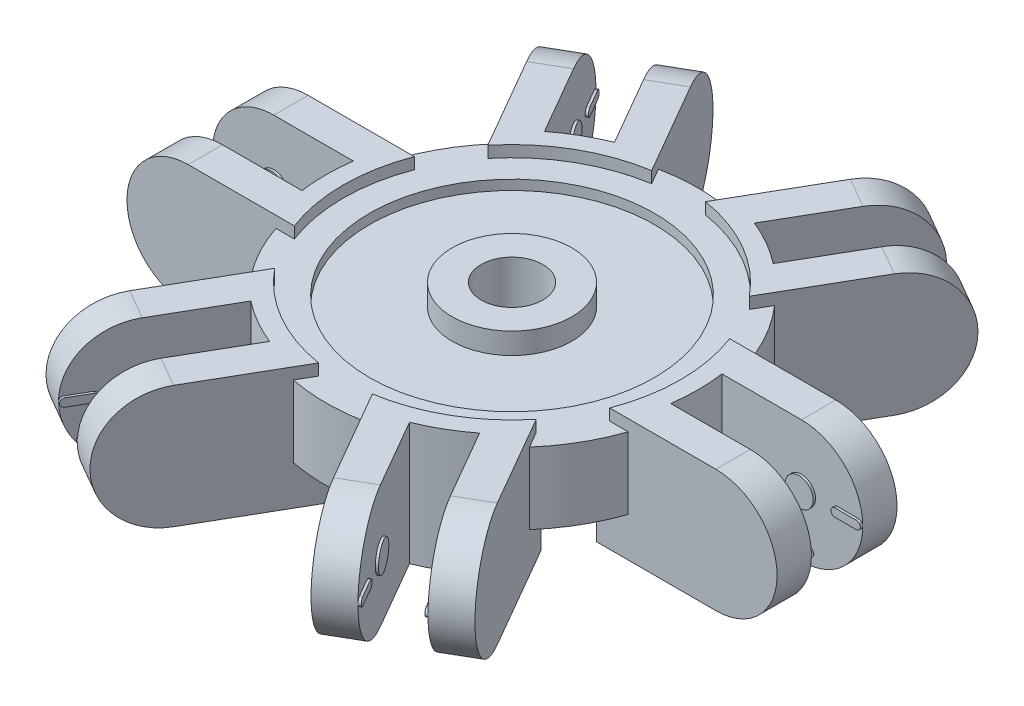
from build123d import *

# Parameters (mm, degrees)
SKETCH1_R                       = 14.9352
BOSS_EXTRUDE1_DEPTH             = 9.8298
SKETCH2_W                       = 13.3858
SKETCH2_H                       = 9.8298
BOSS_EXTRUDE2_DEPTH             = 4.8133
FILLET1_RADIUS                  = 4.9149
FILLET1_LENGTH                  = 9.6266
CUT_EXTRUDE1_DEPTH              = 32.625213497
SKETCH4_R                       = 1.1303
BOSS_EXTRUDE3_DEPTH             = 0.1905
CIRPATTERN5_COUNT               = 6
CIRPATTERN5_COPY_1_SKETCH_R     = 1.1303
CIRPATTERN5_COPY_1_DEPTH        = 0.1905
CIRPATTERN5_COPY_2_SKETCH_R     = 1.1303
CIRPATTERN5_COPY_2_DEPTH        = 0.1905
CIRPATTERN5_COPY_3_SKETCH_R     = 1.1303
CIRPATTERN5_COPY_3_DEPTH        = 0.1905
CIRPATTERN5_COPY_4_SKETCH_R     = 1.1303
CIRPATTERN5_COPY_4_DEPTH        = 0.1905
CIRPATTERN5_COPY_5_SKETCH_R     = 1.1303
CIRPATTERN5_COPY_5_DEPTH        = 0.1905
FILLET1_OF_CIRPATTERN5_2_RADIUS = 4.9149
FILLET1_OF_CIRPATTERN5_2_LENGTH = 9.6266
FILLET1_OF_CIRPATTERN5_3_RADIUS = 4.9149
FILLET1_OF_CIRPATTERN5_3_LENGTH = 9.6266
FILLET1_OF_CIRPATTERN5_4_RADIUS = 4.9149
FILLET1_OF_CIRPATTERN5_4_LENGTH = 9.6266
FILLET1_OF_CIRPATTERN5_5_RADIUS = 4.9149
FILLET1_OF_CIRPATTERN5_5_LENGTH = 9.6266
FILLET1_OF_CIRPATTERN5_6_RADIUS = 4.9149
FILLET1_OF_CIRPATTERN5_6_LENGTH = 9.6266
SKETCH7_R                       = 2.4765
CUT_EXTRUDE2_DEPTH              = 38.442952732
CUT_EXTRUDE5_DEPTH              = 0.9144
CIRPATTERN6_COUNT               = 6
SKETCH10_R                      = 13.5382
CUT_EXTRUDE6_DEPTH              = 0.9144
SKETCH11_R                      = 11.43
CUT_EXTRUDE7_DEPTH              = 0.7874
SKETCH12_R                      = 4.8006
BOSS_EXTRUDE5_DEPTH             = 1.7018
SKETCH13_R                      = 2.4765
CUT_EXTRUDE8_DEPTH              = 38.442952732
CUT_EXTRUDE9_DEPTH              = 3.175
CIRPATTERN7_COUNT               = 6
SKETCH15_R                      = 12.5476
CUT_EXTRUDE10_DEPTH             = 4.6228
SKETCH16_R                      = 6.6548
SKETCH16_R_2                    = 5.5626
BOSS_EXTRUDE6_DEPTH             = 1.4478
SKETCH18_R                      = 1.524
BOSS_EXTRUDE7_DEPTH             = 1.4478
CIRPATTERN8_COUNT               = 6
SKETCH17_R                      = 1.016
CUT_EXTRUDE11_DEPTH             = 1.4478
CIRPATTERN9_COUNT               = 6


with BuildPart() as part:
    # Sketch1 → Boss-Extrude1 (new body)
    with BuildSketch(Plane(origin=(0, 0, 0), x_dir=(1, 0, 0), z_dir=(0, 1, 0))):
        with Locations(Location((0, 0, 0), (0, 0, 270))):
            Circle(SKETCH1_R)
    extrude(amount=BOSS_EXTRUDE1_DEPTH)

    # Sketch2 → Boss-Extrude2 (add, symmetric)
    with BuildSketch(Plane.XY):
        with Locations((19.3929, 4.9149)):
            Rectangle(SKETCH2_W, SKETCH2_H)
    boss_extrude2 = extrude(amount=BOSS_EXTRUDE2_DEPTH, both=True)

    # Fillet1: full round fillet: the end face becomes a half cylinder, R = half its width
    fillet1_face = Plane((26.0858, 4.9149, 0), x_dir=(0, 0, -1), z_dir=(1, 0, 0))  # on the end face: x along it, z out of the body
    fillet1_slab = fillet1_face.offset(-FILLET1_RADIUS / 2) * Box(FILLET1_LENGTH, 2 * FILLET1_RADIUS, FILLET1_RADIUS, mode=Mode.PRIVATE)  # the body's end, R deep
    fillet1_round = Plane((21.1709, 4.9149, 0), x_dir=(1, 0, 0), z_dir=(0, 0, -1)) * Cylinder(FILLET1_RADIUS, FILLET1_LENGTH, mode=Mode.PRIVATE)  # its axis R under the face
    add(fillet1_slab - fillet1_round, mode=Mode.SUBTRACT)

    # Sketch3 → Cut-Extrude1 (cut, through all)
    with BuildSketch(Plane(origin=(0, 9.8298, 0), x_dir=(1, 0, 0), z_dir=(0, 1, 0))):
        with BuildLine():
            Line((14.792812589, -2.0574), (26.0858, -2.0574))
            Line((26.0858, -2.0574), (26.0858, 2.0574))
            Line((26.0858, 2.0574), (14.792812589, 2.0574))
            ThreePointArc((14.792812589, 2.0574), (14.9352, 0), (14.792812589, -2.0574))
        make_face()
    cut_extrude1 = extrude(amount=-CUT_EXTRUDE1_DEPTH, mode=Mode.SUBTRACT)

    # Sketch4 → Boss-Extrude3 (add, symmetric)
    with BuildSketch(Plane.XY.offset(-2.0574)):
        with Locations(Location((21.1709, 4.9149, 0), (0, 0, 180))):
            Circle(SKETCH4_R)
        with BuildLine():
            Line((25.7556, 4.5847), (24.0538, 4.5847))
            ThreePointArc((24.0538, 4.5847), (23.7236, 4.9149), (24.0538, 5.2451))
            Line((24.0538, 5.2451), (25.7556, 5.2451))
            ThreePointArc((25.7556, 5.2451), (26.0858, 4.9149), (25.7556, 4.5847))
        make_face()
    boss_extrude3 = extrude(amount=BOSS_EXTRUDE3_DEPTH, both=True)

    # Mirror1: Boss-Extrude3 across plane
    add(boss_extrude3.mirror(Plane.XY))

    # CirPattern5: Boss-Extrude2, Cut-Extrude1, Boss-Extrude3 ×6 about axis
    cirpattern5_axis = Axis((0, 0, 0), (0, 1, 0))
    add([boss_extrude2.rotate(cirpattern5_axis, i * 360 / CIRPATTERN5_COUNT) for i in range(1, CIRPATTERN5_COUNT)])
    add([cut_extrude1.rotate(cirpattern5_axis, i * 360 / CIRPATTERN5_COUNT) for i in range(1, CIRPATTERN5_COUNT)], mode=Mode.SUBTRACT)
    add([boss_extrude3.rotate(cirpattern5_axis, i * 360 / CIRPATTERN5_COUNT) for i in range(1, CIRPATTERN5_COUNT)])

    # CirPattern5 copy 1 sketch → CirPattern5 copy 1 (add, symmetric)
    with BuildSketch(Plane(origin=(1.781760666, 0, 1.0287), x_dir=(0.5000000000000001, 0, -0.8660254037844386), z_dir=(-0.8660254037844386, 0, -0.5000000000000001))):
        with Locations((21.1709, -4.9149)):
            Circle(CIRPATTERN5_COPY_1_SKETCH_R)
        with BuildLine():
            Line((25.7556, -4.5847), (24.0538, -4.5847))
            ThreePointArc((24.0538, -4.5847), (23.7236, -4.9149), (24.0538, -5.2451))
            Line((24.0538, -5.2451), (25.7556, -5.2451))
            ThreePointArc((25.7556, -5.2451), (26.0858, -4.9149), (25.7556, -4.5847))
        make_face()
    extrude(amount=CIRPATTERN5_COPY_1_DEPTH, both=True)

    # CirPattern5 copy 2 sketch → CirPattern5 copy 2 (add, symmetric)
    with BuildSketch(Plane(origin=(1.781760666, 0, -1.0287), x_dir=(-0.4999999999999998, 0, -0.8660254037844387), z_dir=(-0.8660254037844387, 0, 0.4999999999999998))):
        with Locations((21.1709, -4.9149)):
            Circle(CIRPATTERN5_COPY_2_SKETCH_R)
        with BuildLine():
            Line((25.7556, -4.5847), (24.0538, -4.5847))
            ThreePointArc((24.0538, -4.5847), (23.7236, -4.9149), (24.0538, -5.2451))
            Line((24.0538, -5.2451), (25.7556, -5.2451))
            ThreePointArc((25.7556, -5.2451), (26.0858, -4.9149), (25.7556, -4.5847))
        make_face()
    extrude(amount=CIRPATTERN5_COPY_2_DEPTH, both=True)

    # CirPattern5 copy 3 sketch → CirPattern5 copy 3 (add, symmetric)
    with BuildSketch(Plane(origin=(0, 0, -2.0574), x_dir=(-1, 0, 0), z_dir=(0, 0, 1))):
        with Locations((21.1709, -4.9149)):
            Circle(CIRPATTERN5_COPY_3_SKETCH_R)
        with BuildLine():
            Line((25.7556, -4.5847), (24.0538, -4.5847))
            ThreePointArc((24.0538, -4.5847), (23.7236, -4.9149), (24.0538, -5.2451))
            Line((24.0538, -5.2451), (25.7556, -5.2451))
            ThreePointArc((25.7556, -5.2451), (26.0858, -4.9149), (25.7556, -4.5847))
        make_face()
    extrude(amount=CIRPATTERN5_COPY_3_DEPTH, both=True)

    # CirPattern5 copy 4 sketch → CirPattern5 copy 4 (add, symmetric)
    with BuildSketch(Plane(origin=(-1.781760666, 0, -1.0287), x_dir=(-0.5000000000000004, 0, 0.8660254037844384), z_dir=(0.8660254037844384, 0, 0.5000000000000004))):
        with Locations((21.1709, -4.9149)):
            Circle(CIRPATTERN5_COPY_4_SKETCH_R)
        with BuildLine():
            Line((25.7556, -4.5847), (24.0538, -4.5847))
            ThreePointArc((24.0538, -4.5847), (23.7236, -4.9149), (24.0538, -5.2451))
            Line((24.0538, -5.2451), (25.7556, -5.2451))
            ThreePointArc((25.7556, -5.2451), (26.0858, -4.9149), (25.7556, -4.5847))
        make_face()
    extrude(amount=CIRPATTERN5_COPY_4_DEPTH, both=True)

    # CirPattern5 copy 5 sketch → CirPattern5 copy 5 (add, symmetric)
    with BuildSketch(Plane(origin=(-1.781760666, 0, 1.0287), x_dir=(0.5000000000000001, 0, 0.8660254037844386), z_dir=(0.8660254037844386, 0, -0.5000000000000001))):
        with Locations((21.1709, -4.9149)):
            Circle(CIRPATTERN5_COPY_5_SKETCH_R)
        with BuildLine():
            Line((25.7556, -4.5847), (24.0538, -4.5847))
            ThreePointArc((24.0538, -4.5847), (23.7236, -4.9149), (24.0538, -5.2451))
            Line((24.0538, -5.2451), (25.7556, -5.2451))
            ThreePointArc((25.7556, -5.2451), (26.0858, -4.9149), (25.7556, -4.5847))
        make_face()
    extrude(amount=CIRPATTERN5_COPY_5_DEPTH, both=True)

    # Fillet1 of CirPattern5 2: full round fillet: the end face becomes a half cylinder, R = half its width
    fillet1_of_cirpattern5_2_face = Plane((13.0429, 4.9149, -22.590965478), x_dir=(-0.866025403784, 0, -0.5), z_dir=(0.5, 0, -0.866025403784))  # on the end face: x along it, z out of the body
    fillet1_of_cirpattern5_2_slab = fillet1_of_cirpattern5_2_face.offset(-FILLET1_OF_CIRPATTERN5_2_RADIUS / 2) * Box(FILLET1_OF_CIRPATTERN5_2_LENGTH, 2 * FILLET1_OF_CIRPATTERN5_2_RADIUS, FILLET1_OF_CIRPATTERN5_2_RADIUS, mode=Mode.PRIVATE)  # the body's end, R deep
    fillet1_of_cirpattern5_2_round = Plane((10.58545, 4.9149, -18.334537221), x_dir=(0.5, 0, -0.866025403784), z_dir=(-0.866025403784, 0, -0.5)) * Cylinder(FILLET1_OF_CIRPATTERN5_2_RADIUS, FILLET1_OF_CIRPATTERN5_2_LENGTH, mode=Mode.PRIVATE)  # its axis R under the face
    add(fillet1_of_cirpattern5_2_slab - fillet1_of_cirpattern5_2_round, mode=Mode.SUBTRACT)

    # Fillet1 of CirPattern5 3: full round fillet: the end face becomes a half cylinder, R = half its width
    fillet1_of_cirpattern5_3_face = Plane((-13.0429, 4.9149, -22.590965478), x_dir=(-0.866025403784, 0, 0.5), z_dir=(-0.5, 0, -0.866025403784))  # on the end face: x along it, z out of the body
    fillet1_of_cirpattern5_3_slab = fillet1_of_cirpattern5_3_face.offset(-FILLET1_OF_CIRPATTERN5_3_RADIUS / 2) * Box(FILLET1_OF_CIRPATTERN5_3_LENGTH, 2 * FILLET1_OF_CIRPATTERN5_3_RADIUS, FILLET1_OF_CIRPATTERN5_3_RADIUS, mode=Mode.PRIVATE)  # the body's end, R deep
    fillet1_of_cirpattern5_3_round = Plane((-10.58545, 4.9149, -18.334537221), x_dir=(-0.5, 0, -0.866025403784), z_dir=(-0.866025403784, 0, 0.5)) * Cylinder(FILLET1_OF_CIRPATTERN5_3_RADIUS, FILLET1_OF_CIRPATTERN5_3_LENGTH, mode=Mode.PRIVATE)  # its axis R under the face
    add(fillet1_of_cirpattern5_3_slab - fillet1_of_cirpattern5_3_round, mode=Mode.SUBTRACT)

    # Fillet1 of CirPattern5 4: full round fillet: the end face becomes a half cylinder, R = half its width
    fillet1_of_cirpattern5_4_face = Plane((-26.0858, 4.9149, 0), x_dir=(0, 0, 1), z_dir=(-1, 0, 0))  # on the end face: x along it, z out of the body
    fillet1_of_cirpattern5_4_slab = fillet1_of_cirpattern5_4_face.offset(-FILLET1_OF_CIRPATTERN5_4_RADIUS / 2) * Box(FILLET1_OF_CIRPATTERN5_4_LENGTH, 2 * FILLET1_OF_CIRPATTERN5_4_RADIUS, FILLET1_OF_CIRPATTERN5_4_RADIUS, mode=Mode.PRIVATE)  # the body's end, R deep
    fillet1_of_cirpattern5_4_round = Plane((-21.1709, 4.9149, 0), x_dir=(-1, 0, 0), z_dir=(0, 0, 1)) * Cylinder(FILLET1_OF_CIRPATTERN5_4_RADIUS, FILLET1_OF_CIRPATTERN5_4_LENGTH, mode=Mode.PRIVATE)  # its axis R under the face
    add(fillet1_of_cirpattern5_4_slab - fillet1_of_cirpattern5_4_round, mode=Mode.SUBTRACT)

    # Fillet1 of CirPattern5 5: full round fillet: the end face becomes a half cylinder, R = half its width
    fillet1_of_cirpattern5_5_face = Plane((-13.0429, 4.9149, 22.590965478), x_dir=(0.866025403784, 0, 0.5), z_dir=(-0.5, 0, 0.866025403784))  # on the end face: x along it, z out of the body
    fillet1_of_cirpattern5_5_slab = fillet1_of_cirpattern5_5_face.offset(-FILLET1_OF_CIRPATTERN5_5_RADIUS / 2) * Box(FILLET1_OF_CIRPATTERN5_5_LENGTH, 2 * FILLET1_OF_CIRPATTERN5_5_RADIUS, FILLET1_OF_CIRPATTERN5_5_RADIUS, mode=Mode.PRIVATE)  # the body's end, R deep
    fillet1_of_cirpattern5_5_round = Plane((-10.58545, 4.9149, 18.334537221), x_dir=(-0.5, 0, 0.866025403784), z_dir=(0.866025403784, 0, 0.5)) * Cylinder(FILLET1_OF_CIRPATTERN5_5_RADIUS, FILLET1_OF_CIRPATTERN5_5_LENGTH, mode=Mode.PRIVATE)  # its axis R under the face
    add(fillet1_of_cirpattern5_5_slab - fillet1_of_cirpattern5_5_round, mode=Mode.SUBTRACT)

    # Fillet1 of CirPattern5 6: full round fillet: the end face becomes a half cylinder, R = half its width
    fillet1_of_cirpattern5_6_face = Plane((13.0429, 4.9149, 22.590965478), x_dir=(0.866025403784, 0, -0.5), z_dir=(0.5, 0, 0.866025403784))  # on the end face: x along it, z out of the body
    fillet1_of_cirpattern5_6_slab = fillet1_of_cirpattern5_6_face.offset(-FILLET1_OF_CIRPATTERN5_6_RADIUS / 2) * Box(FILLET1_OF_CIRPATTERN5_6_LENGTH, 2 * FILLET1_OF_CIRPATTERN5_6_RADIUS, FILLET1_OF_CIRPATTERN5_6_RADIUS, mode=Mode.PRIVATE)  # the body's end, R deep
    fillet1_of_cirpattern5_6_round = Plane((10.58545, 4.9149, 18.334537221), x_dir=(0.5, 0, 0.866025403784), z_dir=(0.866025403784, 0, -0.5)) * Cylinder(FILLET1_OF_CIRPATTERN5_6_RADIUS, FILLET1_OF_CIRPATTERN5_6_LENGTH, mode=Mode.PRIVATE)  # its axis R under the face
    add(fillet1_of_cirpattern5_6_slab - fillet1_of_cirpattern5_6_round, mode=Mode.SUBTRACT)

    # Sketch7 → Cut-Extrude2 (cut, through all)
    with BuildSketch(Plane(origin=(0, 9.8298, 0), x_dir=(1, 0, 0), z_dir=(0, 1, 0))):
        with Locations(Location((0, 0, 0), (0, 0, 270))):
            Circle(SKETCH7_R)
    extrude(amount=-CUT_EXTRUDE2_DEPTH, mode=Mode.SUBTRACT)

    # Sketch9 → Cut-Extrude5 (cut)
    with BuildSketch(Plane(origin=(0, 9.8298, 0), x_dir=(1, 0, 0), z_dir=(0, 1, 0))):
        with BuildLine():
            Line((-14.138328832, 4.8133), (-12.653655691, 4.8133))
            ThreePointArc((-12.653655691, 4.8133), (-11.724425122, 6.7691), (-10.495267922, 8.551737279))
            Line((-10.495267922, 8.551737279), (-11.237604492, 9.837501935))
            ThreePointArc((-11.237604492, 9.837501935), (-12.934262611, 7.4676), (-14.138328832, 4.8133))
        make_face()
    cut_extrude5 = extrude(amount=-CUT_EXTRUDE5_DEPTH, mode=Mode.SUBTRACT)

    # CirPattern6: Cut-Extrude5 ×6 about axis
    cirpattern6_axis = Axis((0, 0, 0), (0, 1, 0))
    for i in range(1, CIRPATTERN6_COUNT):
        add(cut_extrude5.rotate(cirpattern6_axis, i * 360 / CIRPATTERN6_COUNT), mode=Mode.SUBTRACT)

    # Sketch10 → Cut-Extrude6 (cut)
    with BuildSketch(Plane(origin=(0, 9.8298, 0), x_dir=(1, 0, 0), z_dir=(0, 1, 0))):
        Circle(SKETCH10_R)
    extrude(amount=-CUT_EXTRUDE6_DEPTH, mode=Mode.SUBTRACT)

    # Sketch11 → Cut-Extrude7 (cut)
    with BuildSketch(Plane(origin=(0, 8.9154, 0), x_dir=(1, 0, 0), z_dir=(0, 1, 0))):
        with Locations(Location((0, 0, 0), (0, 0, 270))):
            Circle(SKETCH11_R)
    extrude(amount=-CUT_EXTRUDE7_DEPTH, mode=Mode.SUBTRACT)

    # Sketch12 → Boss-Extrude5 (add)
    with BuildSketch(Plane(origin=(0, 8.128, 0), x_dir=(1, 0, 0), z_dir=(0, 1, 0))):
        with Locations(Location((0, 0, 0), (0, 0, 90))):
            Circle(SKETCH12_R)
    extrude(amount=BOSS_EXTRUDE5_DEPTH)

    # Sketch13 → Cut-Extrude8 (cut, through all)
    with BuildSketch(Plane(origin=(0, 9.8298, 0), x_dir=(1, 0, 0), z_dir=(0, 1, 0))):
        with Locations(Location((0, 0, 0), (0, 0, 270))):
            Circle(SKETCH13_R)
    extrude(amount=-CUT_EXTRUDE8_DEPTH, mode=Mode.SUBTRACT)

    # Sketch14 → Cut-Extrude9 (cut)
    with BuildSketch(Plane.XZ):
        with BuildLine():
            Line((-14.138328832, 4.8133), (-11.587683499, 4.8133))
            ThreePointArc((-11.587683499, 4.8133), (-10.866540357, 6.2738), (-9.962281825, 7.628578281))
            Line((-9.962281825, 7.628578281), (-11.237604492, 9.837501935))
            ThreePointArc((-11.237604492, 9.837501935), (-12.934262611, 7.4676), (-14.138328832, 4.8133))
        make_face()
    cut_extrude9 = extrude(amount=-CUT_EXTRUDE9_DEPTH, mode=Mode.SUBTRACT)

    # CirPattern7: Cut-Extrude9 ×6 about axis
    cirpattern7_axis = Axis((0, 0, 0), (0, 1, 0))
    for i in range(1, CIRPATTERN7_COUNT):
        add(cut_extrude9.rotate(cirpattern7_axis, i * 360 / CIRPATTERN7_COUNT), mode=Mode.SUBTRACT)

    # Sketch15 → Cut-Extrude10 (cut)
    with BuildSketch(Plane.XZ):
        with Locations(Location((0, 0, 0), (0, 0, 270))):
            Circle(SKETCH15_R)
    extrude(amount=-CUT_EXTRUDE10_DEPTH, mode=Mode.SUBTRACT)

    # Sketch16 → Boss-Extrude6 (add)
    with BuildSketch(Plane(origin=(0, 4.6228, 0), x_dir=(-1, 0, 0), z_dir=(0, -1, 0))):
        with Locations(Location((0, 0, 0), (0, 0, 90))):
            Circle(SKETCH16_R)
        with Locations(Location((0, 0, 0), (0, 0, 90))):
            Circle(SKETCH16_R_2, mode=Mode.SUBTRACT)
    extrude(amount=BOSS_EXTRUDE6_DEPTH)

    # Sketch18 → Boss-Extrude7 (add)
    with BuildSketch(Plane.XZ.offset(-3.175)):
        with Locations((11.38347092, 6.57225)):
            Circle(SKETCH18_R)
    boss_extrude7 = extrude(amount=-BOSS_EXTRUDE7_DEPTH)

    # CirPattern8: Boss-Extrude7 ×6 about axis
    cirpattern8_axis = Axis((0, 0, 0), (0, 1, 0))
    for i in range(1, CIRPATTERN8_COUNT):
        add(boss_extrude7.rotate(cirpattern8_axis, i * 360 / CIRPATTERN8_COUNT))

    # Sketch17 → Cut-Extrude11 (cut)
    with BuildSketch(Plane.XZ.offset(-3.175)):
        with Locations(Location((-11.38347092, -6.57225, 0), (0, 0, 270))):
            Circle(SKETCH17_R)
        with Locations(Location((11.38347092, 6.57225, 0), (0, 0, 270))):
            Circle(SKETCH17_R)
    cut_extrude11 = extrude(amount=-CUT_EXTRUDE11_DEPTH, mode=Mode.SUBTRACT)

    # CirPattern9: Cut-Extrude11 ×6 about axis
    cirpattern9_axis = Axis((0, 0, 0), (0, 1, 0))
    for i in range(1, CIRPATTERN9_COUNT):
        add(cut_extrude11.rotate(cirpattern9_axis, i * 360 / CIRPATTERN9_COUNT), mode=Mode.SUBTRACT)


solid = part.part
